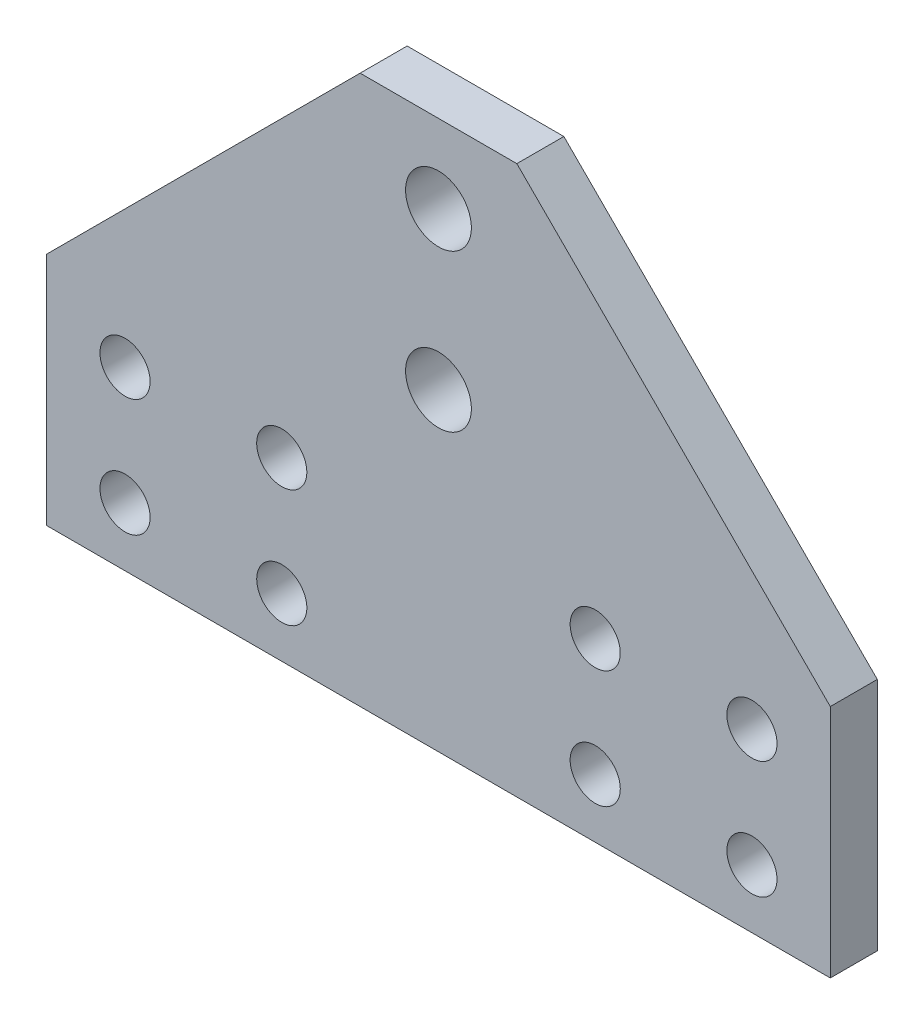
from build123d import *

# Parameters (mm, degrees)
EXTRUDE_1_DEPTH     = 3
SKETCH_2_R          = 1.6
SKETCH_2_R_2        = 2.1
CUT_EXTRUDE_1_DEPTH = 47.19523785


with BuildPart() as part:
    # 草图1 → 凸台-拉伸1 (new body)
    with BuildSketch(Plane.XY):
        Polygon((0, 0), (10, 0), (30, -20), (30, -35), (-20, -35), (-20, -20), align=None)
    extrude(amount=EXTRUDE_1_DEPTH)

    # 草图2 → 切除-拉伸1 (cut, through all)
    with BuildSketch(Plane.XY.offset(3)):
        with Locations((-15, -31.25)):
            Circle(SKETCH_2_R)
        with Locations(Location((-5, -31.25, 0), (0, 0, 180))):
            Circle(SKETCH_2_R)
        with Locations((-5, -23.75)):
            Circle(SKETCH_2_R)
        with Locations(Location((-15, -23.75, 0), (0, 0, 180))):
            Circle(SKETCH_2_R)
        with Locations((25, -23.75)):
            Circle(SKETCH_2_R)
        with Locations(Location((15, -23.75, 0), (0, 0, 180))):
            Circle(SKETCH_2_R)
        with Locations((15, -31.25)):
            Circle(SKETCH_2_R)
        with Locations(Location((25, -31.25, 0), (0, 0, 180))):
            Circle(SKETCH_2_R)
        with Locations((5, -5)):
            Circle(SKETCH_2_R_2)
        with Locations((5, -15)):
            Circle(SKETCH_2_R_2)
    extrude(amount=-CUT_EXTRUDE_1_DEPTH, mode=Mode.SUBTRACT)


solid = part.part
